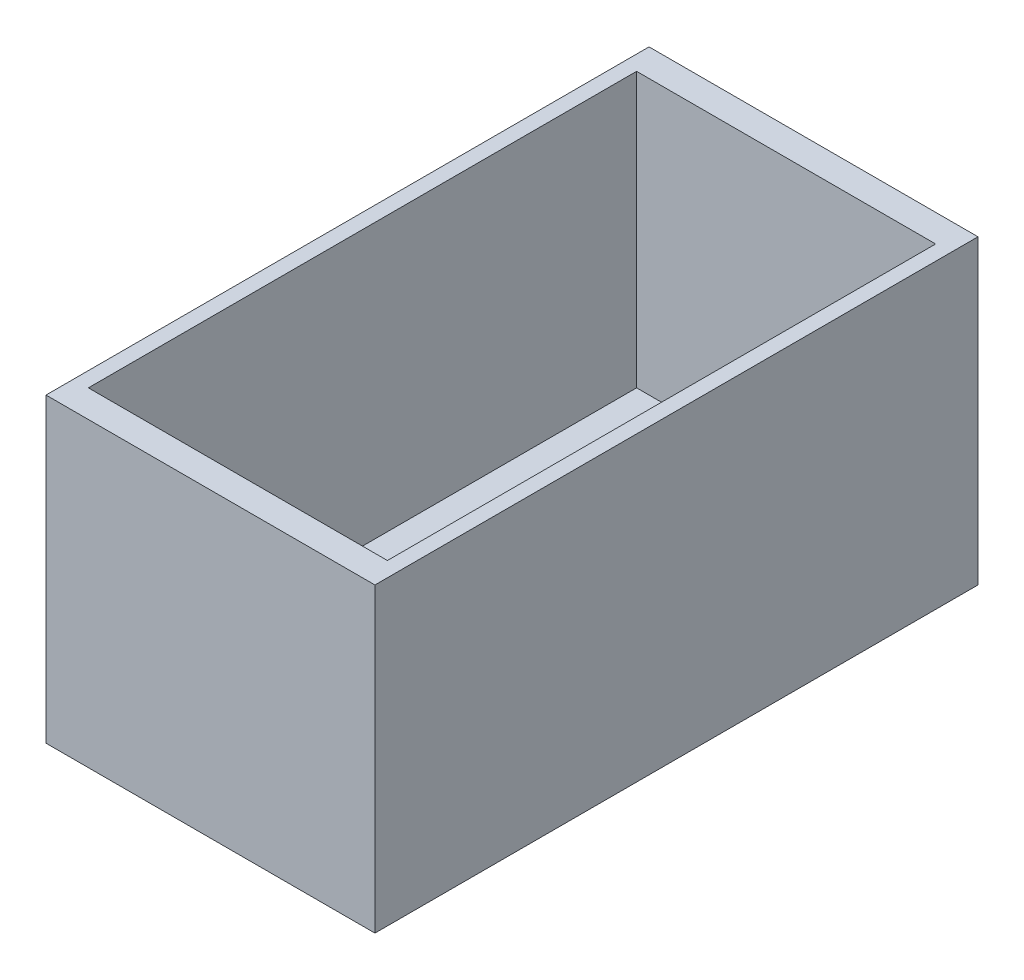
from build123d import *

# Parameters (mm, degrees)
ESBO_O1_W                = 60
ESBO_O1_H                = 110
RESSALTO_EXTRUS_O1_DEPTH = 5
ESBO_O2_W                = 60
ESBO_O2_H                = 110
ESBO_O2_W_2              = 54.545454546
ESBO_O2_H_2              = 100
RESSALTO_EXTRUS_O2_DEPTH = 50


with BuildPart() as part:
    # Esboço1 → Ressalto-extrusão1 (new body)
    with BuildSketch(Plane(origin=(0, 0, 0), x_dir=(1, 0, 0), z_dir=(0, 1, 0))):
        Rectangle(ESBO_O1_W, ESBO_O1_H)
    extrude(amount=RESSALTO_EXTRUS_O1_DEPTH)

    # Esboço2 → Ressalto-extrusão2 (add)
    with BuildSketch(Plane(origin=(0, 5, 0), x_dir=(1, 0, 0), z_dir=(0, 1, 0))):
        Rectangle(ESBO_O2_W, ESBO_O2_H)
        Rectangle(ESBO_O2_W_2, ESBO_O2_H_2, mode=Mode.SUBTRACT)
    extrude(amount=RESSALTO_EXTRUS_O2_DEPTH)


solid = part.part
